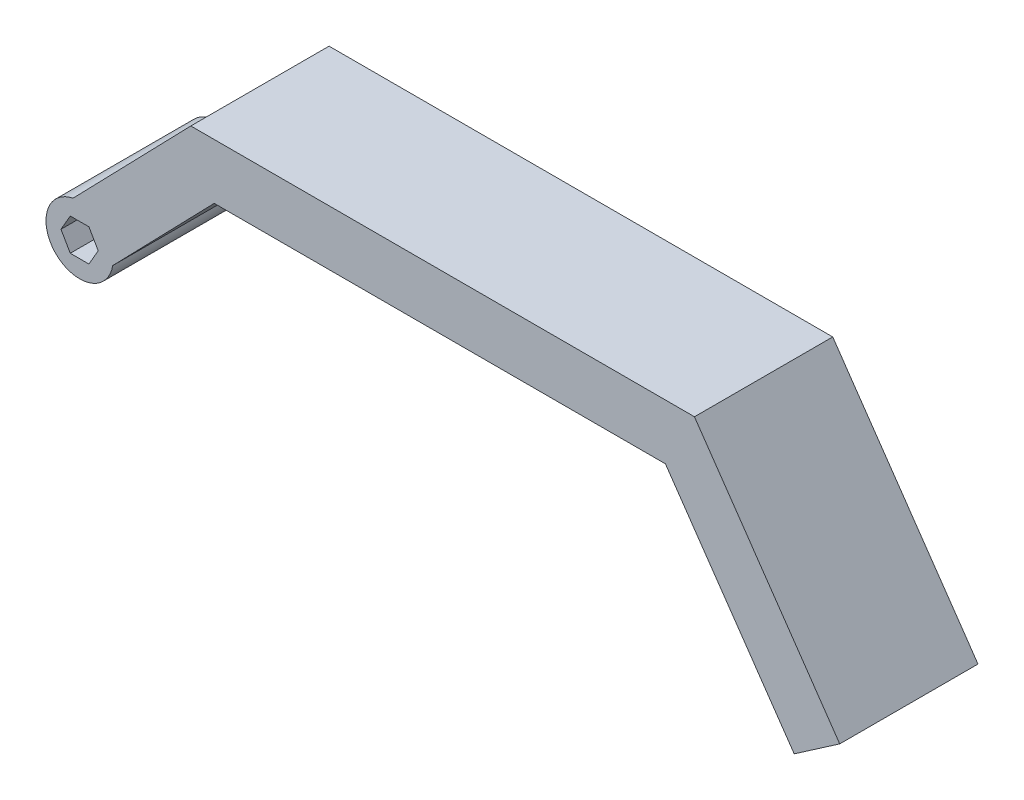
from build123d import *

# Parameters (mm, degrees)
BOSS_EXTRUDE1_DEPTH = 30


with BuildPart() as part:
    # Sketch1 → Boss-Extrude1 (new body)
    with BuildSketch(Plane.XY):
        with BuildLine():
            Line((7.18837747, -1.206261891), (29.208382884, 21.498869199))
            Line((29.208382884, 21.498869199), (127.116350116, 21.498869199))
            Line((127.116350116, 21.498869199), (155.060416965, -19.027825416))
            Line((155.060416965, -19.027825416), (164.939583035, -12.215918359))
            Line((164.939583035, -12.215918359), (133.418209491, 33.498869199))
            Line((133.418209491, 33.498869199), (24.129802766, 33.498869199))
            Line((24.129802766, 33.498869199), (-1.425875737, 7.148056854))
            ThreePointArc((-1.425875737, 7.148056854), (-5.074472088, -5.232358113), (7.18837747, -1.206261891))
        make_face()
        Polygon((4.041451884, 0), (2.020725942, 3.5), (-2.020725942, 3.5), (-4.041451884, 0), (-2.020725942, -3.5), (2.020725942, -3.5), align=None, mode=Mode.SUBTRACT)
    extrude(amount=BOSS_EXTRUDE1_DEPTH)


solid = part.part
